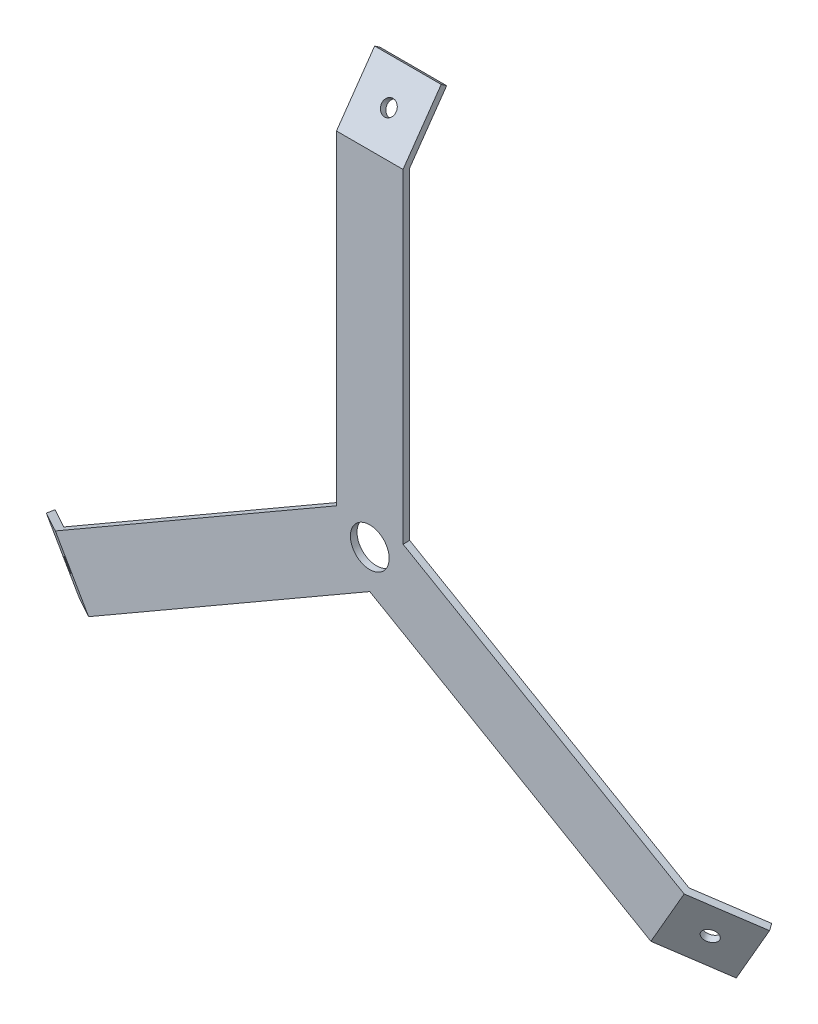
from build123d import *

# Parameters (mm, degrees)
EXTRUDE_1_DEPTH          = 15
PATTERN_CIRCULAR_1_COUNT = 3
HOLE_WIZARD_M161_D       = 17.5
HOLE_WIZARD_M62_D        = 6.6
PATTERN_CIRCULAR_2_COUNT = 3


with BuildPart() as part:
    # Эскиз1 → Вытянуть-Тонкостенный1 (new, symmetric)
    with BuildSketch(Plane(origin=(0, 0, 0), x_dir=(0, 0, -1), z_dir=(1, 0, 0))):
        Polygon((0, 0), (0, 155), (17.207293091, 179.574561329), (19.664749223, 177.85383202), (3, 154.054103633), (3, 0), align=None)
    extrude_1 = extrude(amount=EXTRUDE_1_DEPTH, both=True)

    # Круговой массив1: Вытянуть-Тонкостенный1 ×3 about axis
    pattern_circular_1_axis = Axis((0, 0, 0), (0, 0, -1))
    for i in range(1, PATTERN_CIRCULAR_1_COUNT):
        add(extrude_1.rotate(pattern_circular_1_axis, i * 360 / PATTERN_CIRCULAR_1_COUNT))

    # Отверстие с зазором M161 (through all)
    with Locations(Plane(origin=(0, 0, -3), x_dir=(-1, 0, 0), z_dir=(0, 0, -1))):
        with Locations((0, 0)):
            Hole(HOLE_WIZARD_M161_D / 2)

    # Отверстие с зазором M62 (through all)
    with Locations(Plane(origin=(0, 165.566551355, -11.061102678), x_dir=(0, -0.819152044289, 0.573576436351), z_dir=(0, -0.573576436351, -0.819152044289))):
        with Locations((0, 0)):
            hole_wizard_m62 = Hole(HOLE_WIZARD_M62_D / 2)

    # Круговой массив2: Отверстие с зазором M62 ×3 about axis
    pattern_circular_2_axis = Axis((0, 0, 0), (0, 0, -1))
    for i in range(1, PATTERN_CIRCULAR_2_COUNT):
        add(hole_wizard_m62.rotate(pattern_circular_2_axis, i * 360 / PATTERN_CIRCULAR_2_COUNT), mode=Mode.SUBTRACT)


solid = part.part
